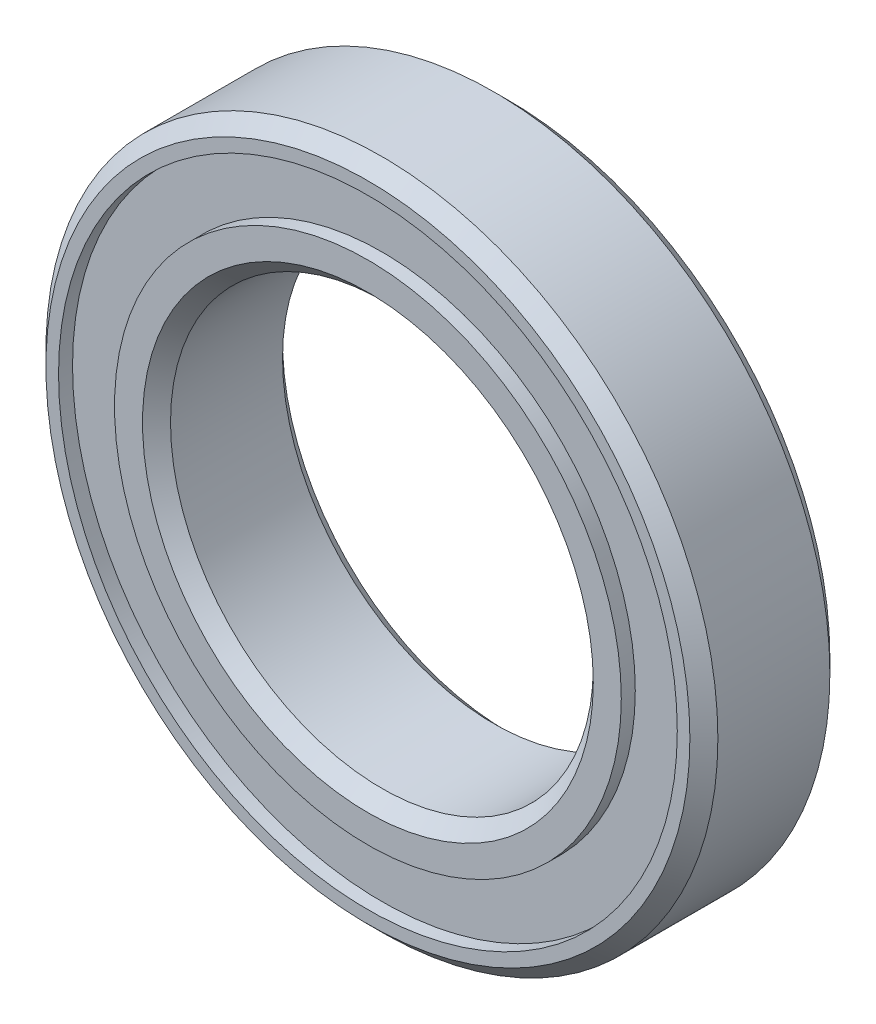
from build123d import *

# Parameters (mm, degrees)
ESBO_O1_R                = 12
ESBO_O1_R_2              = 7.55
RESSALTO_EXTRUS_O1_DEPTH = 5
ESBO_O2_R                = 11.05
ESBO_O2_R_2              = 9.05
CORTE_EXTRUS_O1_DEPTH    = 0.5
CORTE_EXTRUS_O2_START    = -0.5
ESBO_O3_R                = 11.05
ESBO_O3_R_2              = 9.05
CORTE_EXTRUS_O2_DEPTH    = 0.5
CHANFRO1_SIZE            = 0.5


with BuildPart() as part:
    # Esboço1 → Ressalto-extrusão1 (new body)
    with BuildSketch(Plane.XY):
        Circle(ESBO_O1_R)
        Circle(ESBO_O1_R_2, mode=Mode.SUBTRACT)
    extrude(amount=RESSALTO_EXTRUS_O1_DEPTH)

    # Esboço2 → Corte-extrusão1 (cut)
    with BuildSketch(Plane.XY.offset(5)):
        Circle(ESBO_O2_R)
        Circle(ESBO_O2_R_2, mode=Mode.SUBTRACT)
    extrude(amount=-CORTE_EXTRUS_O1_DEPTH, mode=Mode.SUBTRACT)

    # Esboço3 → Corte-extrusão2 (cut)
    with BuildSketch(Plane(origin=(0, 0, 0), x_dir=(-1, 0, 0), z_dir=(0, 0, -1)).offset(CORTE_EXTRUS_O2_START)):
        with Locations(Location((0, 0, 0), (0, 0, 180))):
            Circle(ESBO_O3_R)
        with Locations(Location((0, 0, 0), (0, 0, 180))):
            Circle(ESBO_O3_R_2, mode=Mode.SUBTRACT)
    extrude(amount=CORTE_EXTRUS_O2_DEPTH, mode=Mode.SUBTRACT)

    # Chanfro1
    chanfro1_edges = [part.edges().sort_by_distance(p)[0] for p in [
        (-12, 0, 0),
        (-12, 0, 5),
        (-7.55, 0, 0),
        (-7.55, 0, 5),
    ]]
    chamfer(chanfro1_edges, length=CHANFRO1_SIZE)


solid = part.part
